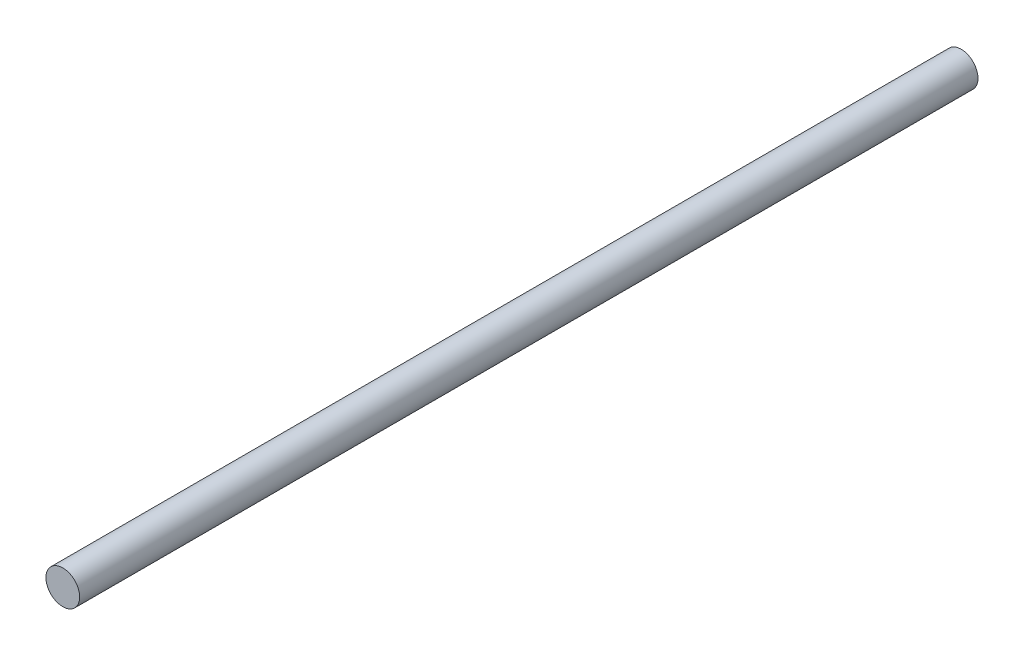
from build123d import *

# Parameters (mm, degrees)
SKETCH1_R           = 15
BOSS_EXTRUDE1_DEPTH = 800


with BuildPart() as part:
    # Sketch1 → Boss-Extrude1 (new body)
    with BuildSketch(Plane.XY):
        Circle(SKETCH1_R)
    extrude(amount=BOSS_EXTRUDE1_DEPTH)


solid = part.part
